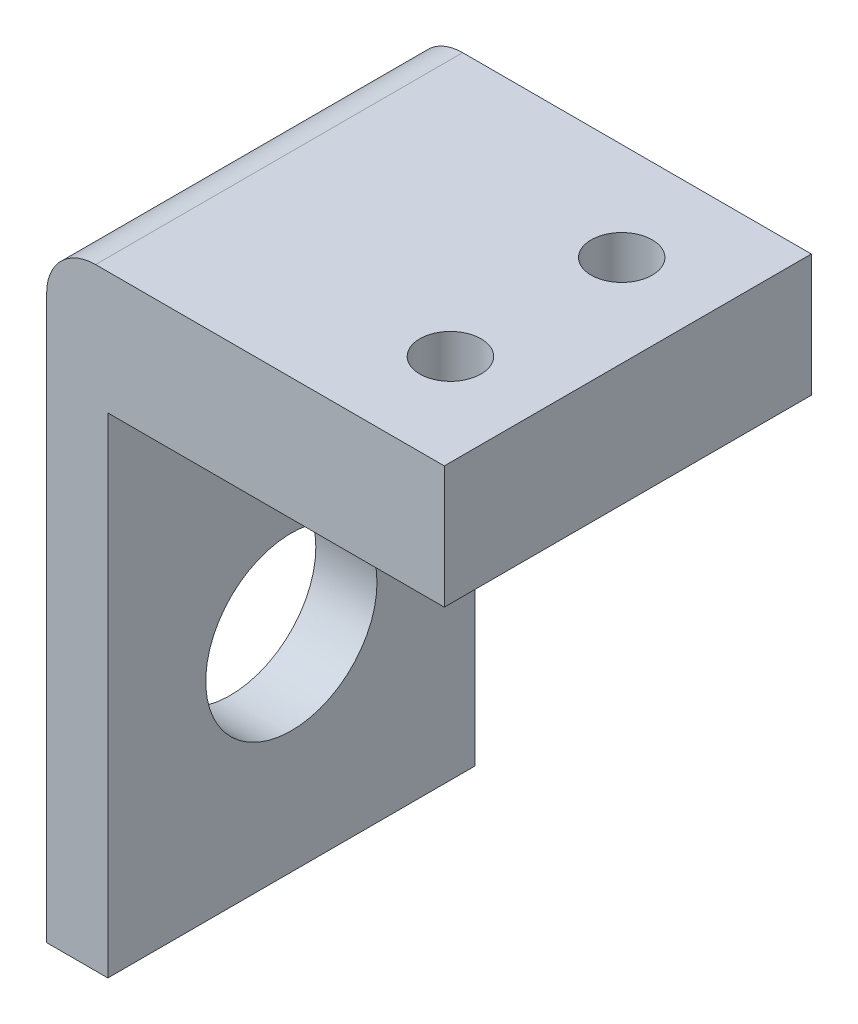
from build123d import *

# Parameters (mm, degrees)
SKETCH1_W                = 30
SKETCH1_H                = 40
SKETCH1_R                = 7
BOSS_EXTRUDE2_DEPTH      = 2.5
BOSS_EXTRUDE3_DEPTH      = 30
BOSS_EXTRUDE3_DEPTH_BACK = 2.5
SKETCH1_7_W              = 30
SKETCH1_7_H              = 10
SKETCH2_R                = 2.5
CUT_EXTRUDE1_DEPTH       = 13
FILLET1_R                = 4


with BuildPart() as part:
    # Sketch1 → Boss-Extrude2 (new, symmetric)
    with BuildSketch(Plane(origin=(0, 0, 0), x_dir=(0, 0, -1), z_dir=(1, 0, 0))):
        with Locations((0, 3)):
            Rectangle(SKETCH1_W, SKETCH1_H)
        Circle(SKETCH1_R, mode=Mode.SUBTRACT)
    extrude(amount=BOSS_EXTRUDE2_DEPTH, both=True)

    # Sketch1<7> → Boss-Extrude3 (add, two sides: drawn at the far end of the back side and taken through both)
    with BuildSketch(Plane(origin=(0, 0, 0), x_dir=(0, 0, -1), z_dir=(1, 0, 0)).offset(-BOSS_EXTRUDE3_DEPTH_BACK)):
        with Locations((0, 28)):
            Rectangle(SKETCH1_7_W, SKETCH1_7_H)
    extrude(amount=BOSS_EXTRUDE3_DEPTH + BOSS_EXTRUDE3_DEPTH_BACK)

    # Sketch2 → Cut-Extrude1 (cut)
    with BuildSketch(Plane(origin=(0, 33, 0), x_dir=(1, 0, 0), z_dir=(0, 1, 0))):
        with Locations((22.5, -7)):
            Circle(SKETCH2_R)
        with Locations((22.5, 7)):
            Circle(SKETCH2_R)
    extrude(amount=-CUT_EXTRUDE1_DEPTH, mode=Mode.SUBTRACT)

    # Fillet1
    fillet1_edges = [part.edges().sort_by_distance(p)[0] for p in [
        (-2.5, 33, 0),
    ]]
    fillet(fillet1_edges, radius=FILLET1_R)


solid = part.part
